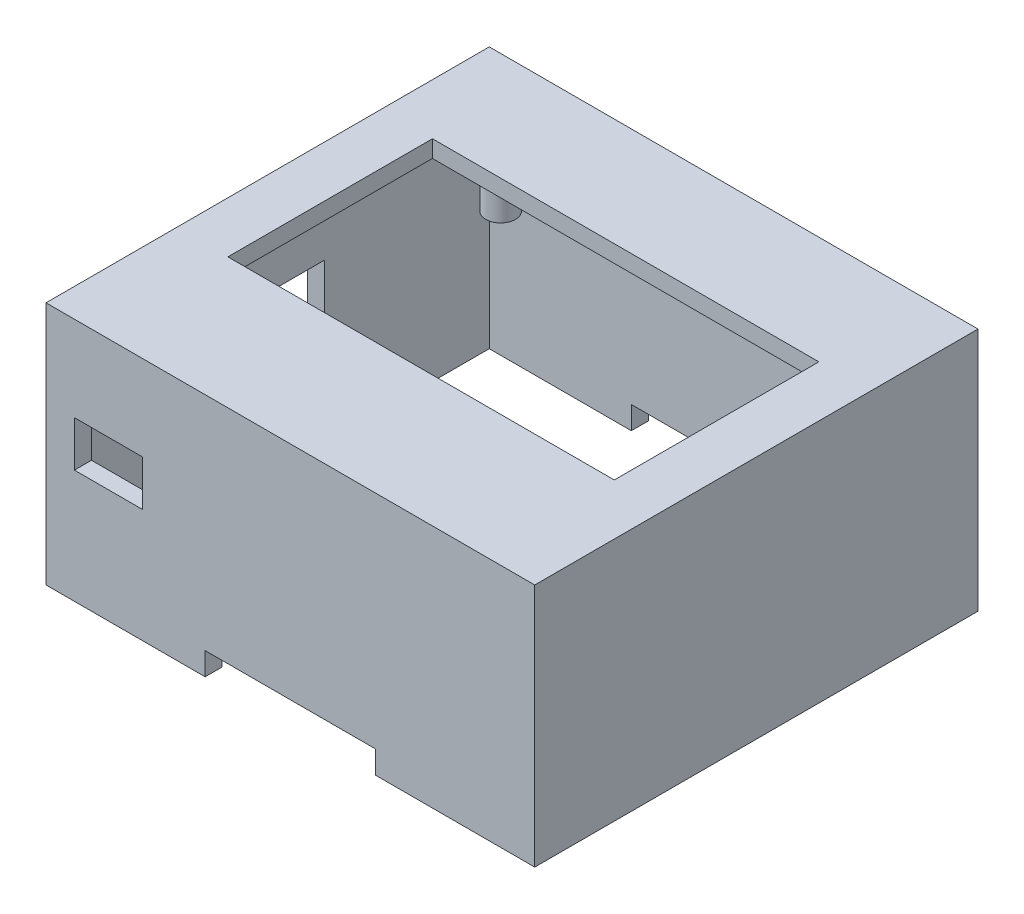
from build123d import *

# Parameters (mm, degrees)
SKETCH_1_W             = 43
SKETCH_1_H             = 39
BODY_DEPTH             = 1.5
SKETCH_3_R             = 1.3
OLED_PILLAR_DEPTH      = 5
OLED_WINDOW_REACH      = 31.745
SKETCH_2_W             = 34
SKETCH_2_H             = 18
SKETCH_4_W             = 43
SKETCH_4_H             = 39
SKETCH_4_W_2           = 40
SKETCH_4_H_2           = 36
FARMFEELWALL_DEPTH     = 20
MICRO5PIN_WINDOW_REACH = 53.276
SKETCH_7_W             = 12
SKETCH_7_H             = 5
RESET_WINDOW_REACH     = 50.819
SKETCH_9_W             = 6
SKETCH_9_H             = 4
SKETCH_10_W            = 15
SKETCH_10_H            = 1.5
CUT_EXTRUDE_1_DEPTH    = 2


with BuildPart() as part:
    # 스케치1 → Body (new body)
    with BuildSketch(Plane(origin=(0, 0, 0), x_dir=(1, 0, 0), z_dir=(0, 1, 0))):
        Rectangle(SKETCH_1_W, SKETCH_1_H)
    extrude(amount=BODY_DEPTH)

    # 스케치3 → OLED_pillar (add)
    with BuildSketch(Plane.XZ):
        with Locations(Location((15, 14, 0), (0, 0, 90))):
            Circle(SKETCH_3_R)
        with Locations(Location((-15, -14, 0), (0, 0, 90))):
            Circle(SKETCH_3_R)
    extrude(amount=OLED_PILLAR_DEPTH)

    # 스케치2 → OLED_window (cut, up to next)
    with BuildSketch(Plane(origin=(0, 1.5, 0), x_dir=(1, 0, 0), z_dir=(0, 1, 0)), mode=Mode.PRIVATE) as oled_window_sk1:
        with Locations((0, 1)):
            Rectangle(SKETCH_2_W, SKETCH_2_H)
    oled_window_tool1 = extrude(oled_window_sk1.sketch, amount=-OLED_WINDOW_REACH, mode=Mode.PRIVATE) & part.part
    add(oled_window_tool1.solids().sort_by_distance((0, 1.5, -1))[0], mode=Mode.SUBTRACT)

    # 스케치4 → FarmFeelWall (add)
    with BuildSketch(Plane.XZ):
        Rectangle(SKETCH_4_W, SKETCH_4_H)
        Rectangle(SKETCH_4_W_2, SKETCH_4_H_2, mode=Mode.SUBTRACT)
    extrude(amount=FARMFEELWALL_DEPTH)

    # 스케치7 → micro5pin_window (cut, up to next)
    with BuildSketch(Plane.ZY.offset(21.5), mode=Mode.PRIVATE) as micro5pin_window_sk1:
        with Locations((2.5, -8.5)):
            Rectangle(SKETCH_7_W, SKETCH_7_H)
    micro5pin_window_tool1 = extrude(micro5pin_window_sk1.sketch, amount=-MICRO5PIN_WINDOW_REACH, mode=Mode.PRIVATE) & part.part
    add(micro5pin_window_tool1.solids().sort_by_distance((-21.5, -8.5, 2.5))[0], mode=Mode.SUBTRACT)

    # 스케치9 → reset_window (cut, up to next)
    with BuildSketch(Plane.XY.offset(19.5), mode=Mode.PRIVATE) as reset_window_sk1:
        with Locations((-16, -8)):
            Rectangle(SKETCH_9_W, SKETCH_9_H)
    reset_window_tool1 = extrude(reset_window_sk1.sketch, amount=-RESET_WINDOW_REACH, mode=Mode.PRIVATE) & part.part
    add(reset_window_tool1.solids().sort_by_distance((-16, -8, 19.5))[0], mode=Mode.SUBTRACT)

    # 스케치10 → 컷-돌출1 (cut)
    with BuildSketch(Plane.XZ.offset(20)):
        with Locations((0, -18.75)):
            Rectangle(SKETCH_10_W, SKETCH_10_H)
        with Locations((0, 18.75)):
            Rectangle(SKETCH_10_W, SKETCH_10_H)
    extrude(amount=-CUT_EXTRUDE_1_DEPTH, mode=Mode.SUBTRACT)


solid = part.part
